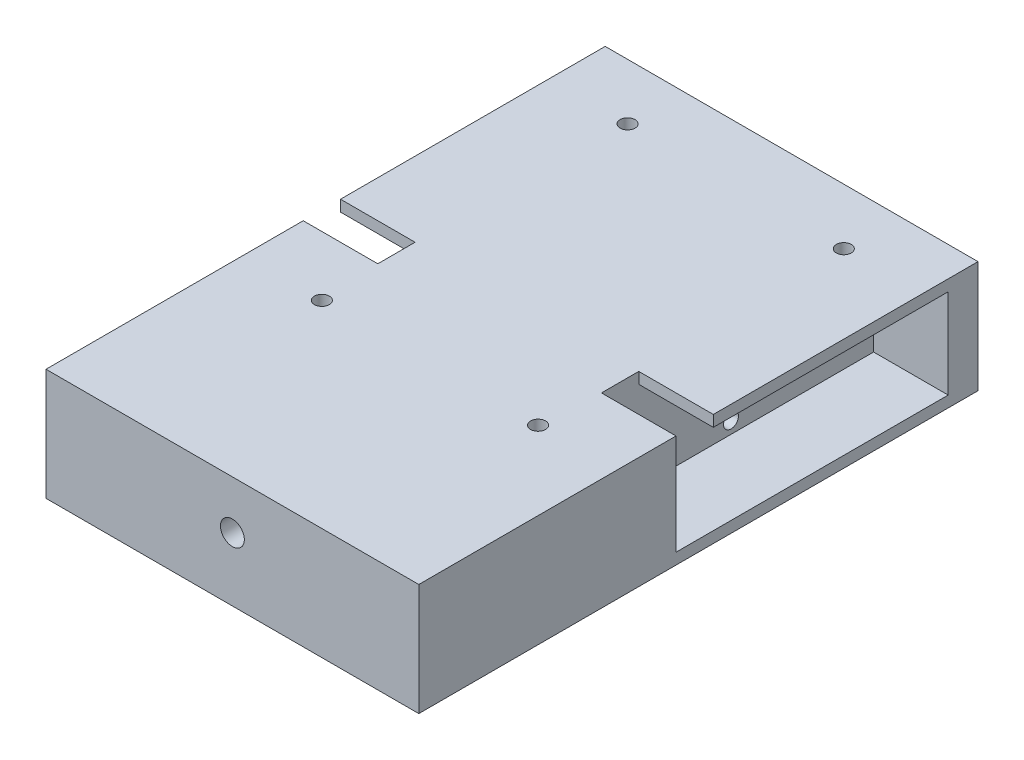
from build123d import *

# Parameters (mm, degrees)
SKETCH1_W                    = 100
SKETCH1_H                    = 150
BOX_DEPTH                    = 30
SKETCH2_W                    = 73
SKETCH2_H                    = 24
MOTOR_COMPARTMENT_DEPTH      = 20
SKETCH3_W                    = 10
SKETCH3_H                    = 3
MOTOR_WIRE_PASSTHROUGH_DEPTH = 20
SKETCH4_R                    = 1.75
SKETCH4_R_2                  = 2
MOTOR_SCREW_MOUNT_DEPTH      = 10
SKETCH5_R                    = 2
MAKER_PI_MOUNT_HOLES_DEPTH   = 8
SKETCH6_W                    = 24
SKETCH6_H                    = 28
CASTER_MOUNT_DEPTH           = 1
SKETCH7_R                    = 3.2
FRONT_MOUNT_HOLE_DEPTH       = 25.4


with BuildPart() as part:
    # Sketch1 → box (new body)
    with BuildSketch(Plane(origin=(0, 0, 0), x_dir=(1, 0, 0), z_dir=(0, 1, 0))):
        Rectangle(SKETCH1_W, SKETCH1_H)
    extrude(amount=-BOX_DEPTH)

    # Sketch2 → motor compartment (cut)
    with BuildSketch(Plane(origin=(50, 0, 0), x_dir=(0, 0, -1), z_dir=(1, 0, 0))):
        with Locations((30.5, -15)):
            Rectangle(SKETCH2_W, SKETCH2_H)
    motor_compartment = extrude(amount=-MOTOR_COMPARTMENT_DEPTH, mode=Mode.SUBTRACT)

    # Sketch3 → motor wire passthrough (cut)
    with BuildSketch(Plane(origin=(50, 0, 0), x_dir=(0, 0, -1), z_dir=(1, 0, 0))):
        with Locations((-1, -1.5)):
            Rectangle(SKETCH3_W, SKETCH3_H)
    motor_wire_passthrough = extrude(amount=-MOTOR_WIRE_PASSTHROUGH_DEPTH, mode=Mode.SUBTRACT)

    # Sketch4 → motor screw mount (cut)
    with BuildSketch(Plane(origin=(30, 0, 0), x_dir=(0, 0, -1), z_dir=(1, 0, 0))):
        with Locations((63, -15)):
            Circle(SKETCH4_R)
        with Locations((28.75, -6.25)):
            Circle(SKETCH4_R_2)
        with Locations(Location((28.75, -23.75, 0), (0, 0, 180))):
            Circle(SKETCH4_R_2)
    motor_screw_mount = extrude(amount=-MOTOR_SCREW_MOUNT_DEPTH, mode=Mode.SUBTRACT)

    # motor compartment mirror: motor compartment, motor wire passthrough, motor screw mount across plane
    add(motor_compartment.mirror(Plane(origin=(0, 0, 0), x_dir=(0, 0, 1), z_dir=(1, 0, 0))), mode=Mode.SUBTRACT)
    add(motor_wire_passthrough.mirror(Plane(origin=(0, 0, 0), x_dir=(0, 0, 1), z_dir=(1, 0, 0))), mode=Mode.SUBTRACT)
    add(motor_screw_mount.mirror(Plane(origin=(0, 0, 0), x_dir=(0, 0, 1), z_dir=(1, 0, 0))), mode=Mode.SUBTRACT)

    # Sketch5 → Maker Pi mount holes (cut)
    with BuildSketch(Plane(origin=(0, 0, 0), x_dir=(1, 0, 0), z_dir=(0, 1, 0))):
        with Locations(Location((-29, 60, 0), (0, 0, 270))):
            Circle(SKETCH5_R)
        with Locations(Location((-29, -22, 0), (0, 0, 270))):
            Circle(SKETCH5_R)
        with Locations(Location((29, 60, 0), (0, 0, 300))):
            Circle(SKETCH5_R)
        with Locations(Location((29, -22, 0), (0, 0, 90))):
            Circle(SKETCH5_R)
    extrude(amount=-MAKER_PI_MOUNT_HOLES_DEPTH, mode=Mode.SUBTRACT)

    # Sketch6 → caster mount (cut)
    with BuildSketch(Plane.XZ.offset(30)):
        with Locations((0, 51)):
            Rectangle(SKETCH6_W, SKETCH6_H)
    extrude(amount=-CASTER_MOUNT_DEPTH, mode=Mode.SUBTRACT)

    # Sketch7 → front mount hole (cut)
    with BuildSketch(Plane.XY.offset(75)):
        with Locations((0, -13)):
            Circle(SKETCH7_R)
    front_mount_hole = extrude(amount=-FRONT_MOUNT_HOLE_DEPTH, mode=Mode.SUBTRACT)

    # back mount hole: front mount hole across plane
    add(front_mount_hole.mirror(Plane.XY), mode=Mode.SUBTRACT)


solid = part.part
